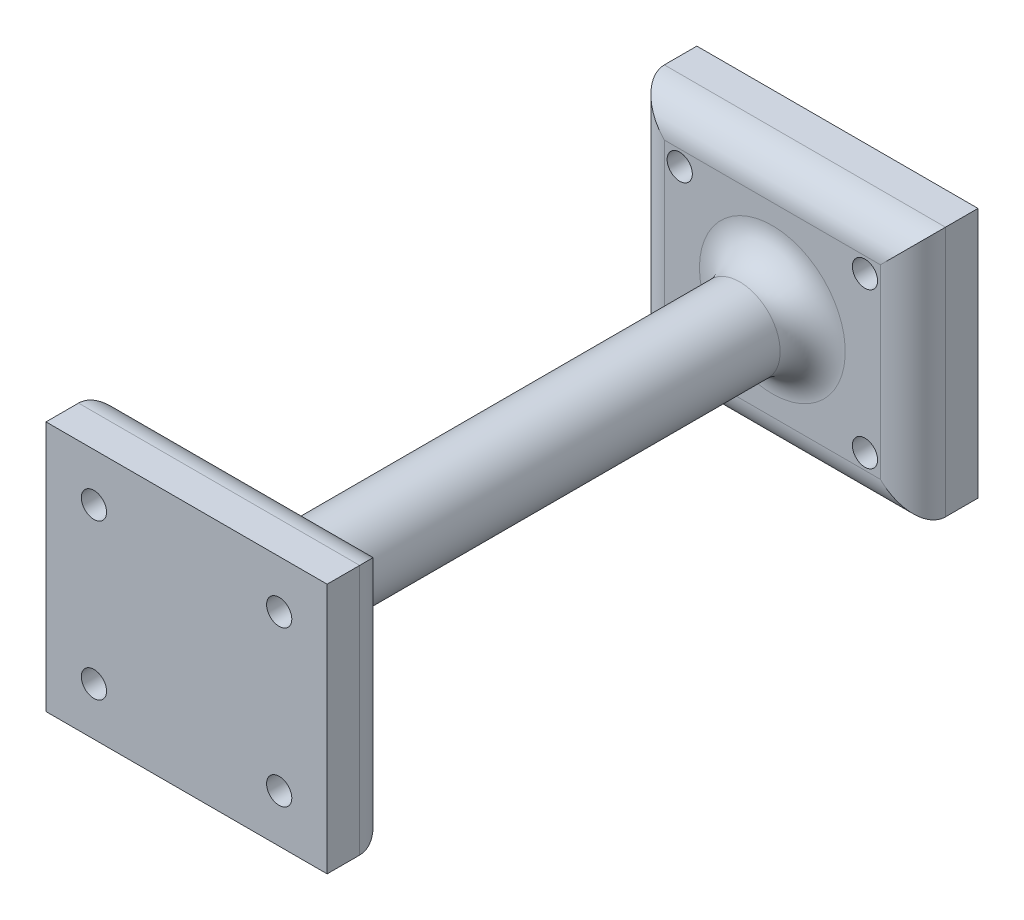
from build123d import *

# Parameters (mm, degrees)
SKETCH1_W           = 43.193201396
SKETCH1_H           = 38.550718919
BOSS_EXTRUDE1_DEPTH = 10
SKETCH2_R           = 6.202002341
BOSS_EXTRUDE2_DEPTH = 79.85
SKETCH3_W           = 43.193201396
SKETCH3_H           = 38.550718919
BOSS_EXTRUDE3_DEPTH = 10
FILLET2_R           = 5
FILLET5_R           = 5
FILLET6_R           = 5
SKETCH5_R           = 1.937143187
CUT_EXTRUDE3_DEPTH  = 10
SKETCH4_R           = 1.937143187
CUT_EXTRUDE4_DEPTH  = 10


with BuildPart() as part:
    # Sketch1 → Boss-Extrude1 (new body)
    with BuildSketch(Plane.XY):
        with Locations((-91.710148042, -274.010852562)):
            Rectangle(SKETCH1_W, SKETCH1_H)
    extrude(amount=BOSS_EXTRUDE1_DEPTH)

    # Sketch2 → Boss-Extrude2 (add)
    with BuildSketch(Plane.XY.offset(10)):
        with Locations((-91.710148042, -274.010852562)):
            Circle(SKETCH2_R)
    extrude(amount=BOSS_EXTRUDE2_DEPTH)

    # Fillet2
    fillet2_edges = [part.edges().sort_by_distance(p)[0] for p in [
        (-97.912150383, -274.010852562, 10),
    ]]
    fillet(fillet2_edges, radius=FILLET2_R)

    # Fillet6
    fillet6_edges = [part.edges().sort_by_distance(p)[0] for p in [
        (-70.113547344, -274.010852562, 10),
        (-91.710148042, -254.735493102, 10),
        (-113.30674874, -274.010852562, 10),
        (-91.710148042, -293.286212021, 10),
    ]]
    fillet(fillet6_edges, radius=FILLET6_R)

    # Sketch4 → Cut-Extrude4 (cut)
    with BuildSketch(Plane.XY.offset(10)):
        with Locations(Location((-77.479547344, -285.920212021, 0), (0, 0, 180))):
            Circle(SKETCH4_R)
        with Locations(Location((-105.94074874, -285.920212021, 0), (0, 0, 180))):
            Circle(SKETCH4_R)
        with Locations(Location((-77.479547344, -262.101493102, 0), (0, 0, 180))):
            Circle(SKETCH4_R)
        with Locations(Location((-105.94074874, -262.101493102, 0), (0, 0, 180))):
            Circle(SKETCH4_R)
    extrude(amount=-CUT_EXTRUDE4_DEPTH, mode=Mode.SUBTRACT)


with BuildPart() as body_2:
    # Sketch3 → Boss-Extrude3 (new body)
    with BuildSketch(Plane(origin=(0, 0, 100), x_dir=(-1, 0, 0), z_dir=(0, 0, -1))):
        with Locations((91.710148042, -274.010852562)):
            Rectangle(SKETCH3_W, SKETCH3_H)
    extrude(amount=BOSS_EXTRUDE3_DEPTH)

    # Fillet5
    fillet5_edges = [body_2.edges().sort_by_distance(p)[0] for p in [
        (-91.710148042, -254.735493102, 90),
        (-70.113547344, -274.010852562, 90),
        (-91.710148042, -293.286212021, 90),
        (-113.30674874, -274.010852562, 90),
    ]]
    fillet(fillet5_edges, radius=FILLET5_R)

    # Sketch5 → Cut-Extrude3 (cut)
    with BuildSketch(Plane(origin=(0, 0, 100), x_dir=(-1, 0, 0), z_dir=(0, 0, -1))):
        with Locations((105.94074874, -285.920212021)):
            Circle(SKETCH5_R)
        with Locations((105.94074874, -262.101493102)):
            Circle(SKETCH5_R)
        with Locations((77.479547344, -262.101493102)):
            Circle(SKETCH5_R)
        with Locations((77.479547344, -285.920212021)):
            Circle(SKETCH5_R)
    extrude(amount=CUT_EXTRUDE3_DEPTH, mode=Mode.SUBTRACT)


solid = Compound([part.part, body_2.part])
